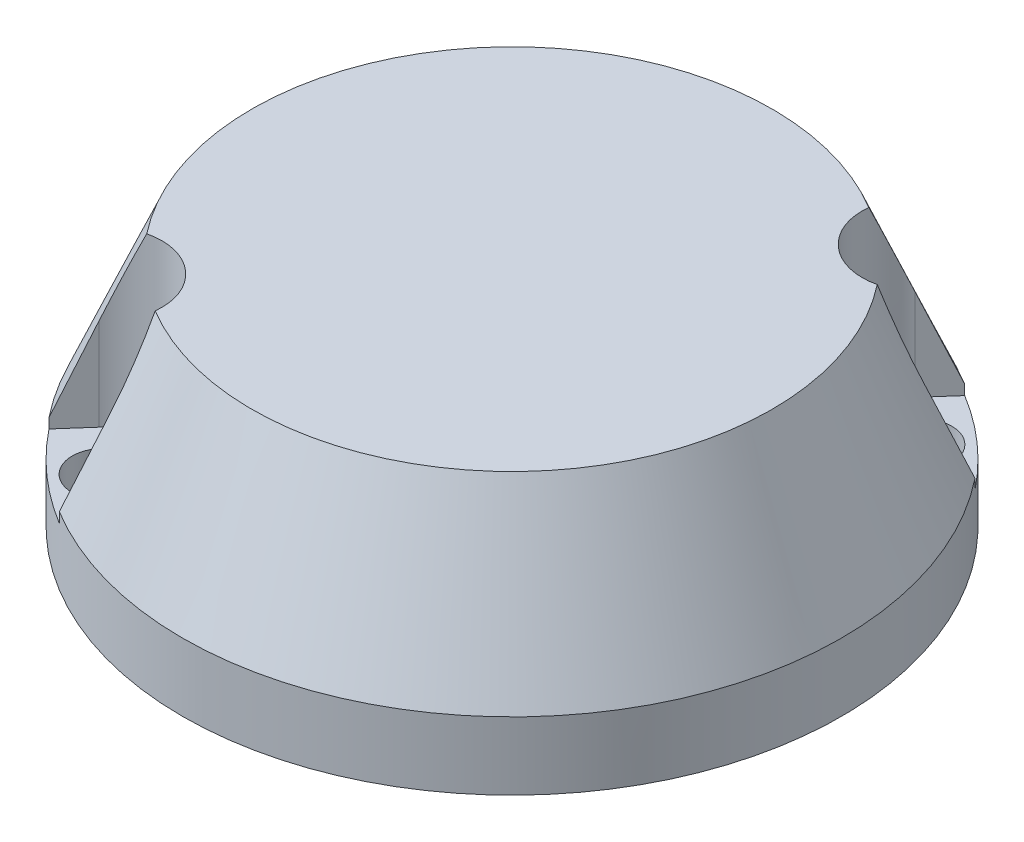
from build123d import *

# Parameters (mm, degrees)
SKETCH1_R           = 11.4
BOSS_EXTRUDE1_DEPTH = 8
SKETCH2_OUTSIDE_W   = 38.236
SKETCH2_OUTSIDE_H   = 38.236
SKETCH2_OUTSIDE_R   = 9
CUT_EXTRUDE1_DEPTH  = 8
CUT_EXTRUDE1_DRAFT  = -23
SKETCH3_R           = 1.1
CUT_EXTRUDE2_DEPTH  = 8
CUT_EXTRUDE3_DEPTH  = 6
CIRPATTERN1_COUNT   = 2
SKETCH5_R           = 7.75
CUT_EXTRUDE5_DEPTH  = 6.5


with BuildPart() as part:
    # Sketch1 → Boss-Extrude1 (new body)
    with BuildSketch(Plane(origin=(0, 0, 0), x_dir=(1, 0, 0), z_dir=(0, 1, 0))):
        with Locations(Location((0, 0, 0), (0, 0, 270))):
            Circle(SKETCH1_R)
    extrude(amount=BOSS_EXTRUDE1_DEPTH)


with BuildPart() as cut_extrude1_tool:
    # Sketch2 outside → Cut-Extrude1 (with draft: the straight prism first)
    with BuildSketch(Plane(origin=(0, 8, 0), x_dir=(1, 0, 0), z_dir=(0, 1, 0))):
        Rectangle(SKETCH2_OUTSIDE_W, SKETCH2_OUTSIDE_H)
        Circle(SKETCH2_OUTSIDE_R, mode=Mode.SUBTRACT)
    extrude(amount=-CUT_EXTRUDE1_DEPTH)
    # Cut-Extrude1: the draft: its side faces are tilted about the plane it starts from
    cut_extrude1_sides = [cut_extrude1_tool.faces().sort_by_distance(p)[0] for p in [
        (0, 4, 19.118),
        (19.118, 4, 0),
        (0, 4, -19.118),
        (-19.118, 4, 0),
        (-9, 4, 0),
    ]]
    draft(cut_extrude1_sides, Plane(origin=(0, 8, 0), x_dir=(1, 0, 0), z_dir=(0, 1, 0)), CUT_EXTRUDE1_DRAFT)


with BuildPart() as part_1:
    add(part.part)

    # Cut-Extrude1: cut by cut_extrude1_tool
    add(cut_extrude1_tool.part, mode=Mode.SUBTRACT)

    # Sketch3 → Cut-Extrude2 (cut)
    with BuildSketch(Plane.XZ):
        with Locations(Location((-6.610810867, 7.503144653, 0), (0, 0, 270))):
            Circle(SKETCH3_R)
    cut_extrude2 = extrude(amount=-CUT_EXTRUDE2_DEPTH, mode=Mode.SUBTRACT)

    # Sketch4 → Cut-Extrude3 (cut)
    with BuildSketch(Plane(origin=(0, 8, 0), x_dir=(1, 0, 0), z_dir=(0, 1, 0))):
        with BuildLine():
            Line((-8.111439797, -6.18098248), (-10.53240187, -8.928728406))
            Line((-10.53240187, -8.928728406), (-7.531144009, -11.573052753))
            Line((-7.531144009, -11.573052753), (-5.110181936, -8.825306826))
            ThreePointArc((-5.110181936, -8.825306826), (-5.288648693, -6.002515722), (-8.111439797, -6.18098248))
        make_face()
    cut_extrude3 = extrude(amount=-CUT_EXTRUDE3_DEPTH, mode=Mode.SUBTRACT)

    # CirPattern1: Cut-Extrude2, Cut-Extrude3 ×2 about axis
    cirpattern1_axis = Axis((0, 0, 0), (0, 1, 0))
    add([cut_extrude2.rotate(cirpattern1_axis, i * 360 / CIRPATTERN1_COUNT) for i in range(1, CIRPATTERN1_COUNT)], mode=Mode.SUBTRACT)
    add([cut_extrude3.rotate(cirpattern1_axis, i * 360 / CIRPATTERN1_COUNT) for i in range(1, CIRPATTERN1_COUNT)], mode=Mode.SUBTRACT)

    # Sketch5 → Cut-Extrude5 (cut)
    with BuildSketch(Plane.XZ):
        with Locations(Location((0, 0, 0), (0, 0, 270))):
            Circle(SKETCH5_R)
    extrude(amount=-CUT_EXTRUDE5_DEPTH, mode=Mode.SUBTRACT)


solid = part_1.part
